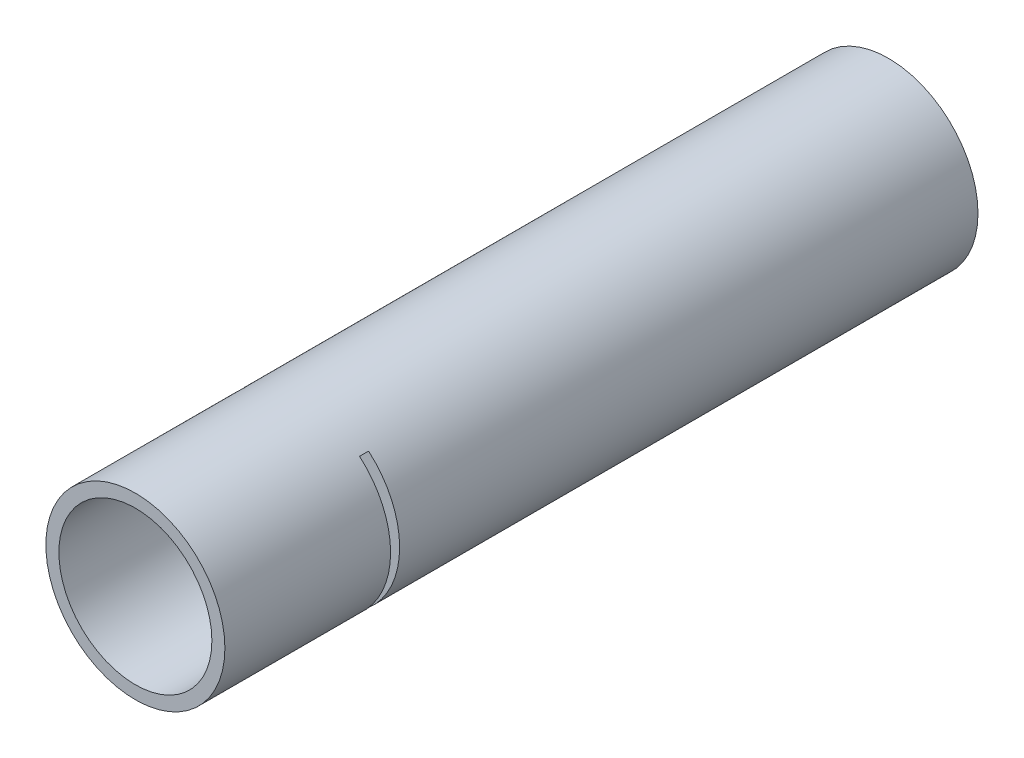
from build123d import *

# Parameters (mm, degrees)
CROQUIS1_R                 = 29.72
CROQUIS1_R_2               = 25.4
SALIENTE_EXTRUIR1_DEPTH    = 250
CORTAR_EXTRUIR1_DEPTH      = 254.508494532
CORTAR_EXTRUIR1_DEPTH_BACK = 254.508494532
CROQUIS2_W                 = 3
CROQUIS2_H                 = 45


with BuildPart() as part:
    # Croquis1 → Saliente-Extruir1 (new body)
    with BuildSketch(Plane.XY):
        Circle(CROQUIS1_R)
        Circle(CROQUIS1_R_2, mode=Mode.SUBTRACT)
    extrude(amount=SALIENTE_EXTRUIR1_DEPTH)

    # Croquis2 → Cortar-Extruir1 (cut, two sides: drawn at the far end of the back side and taken through both)
    with BuildSketch(Plane(origin=(0, 0, 0), x_dir=(0, 0, -1), z_dir=(1, 0, 0)).offset(-CORTAR_EXTRUIR1_DEPTH_BACK)):
        with Locations((-193.5, 0)):
            Rectangle(CROQUIS2_W, CROQUIS2_H)
    extrude(amount=CORTAR_EXTRUIR1_DEPTH + CORTAR_EXTRUIR1_DEPTH_BACK, mode=Mode.SUBTRACT)


solid = part.part
